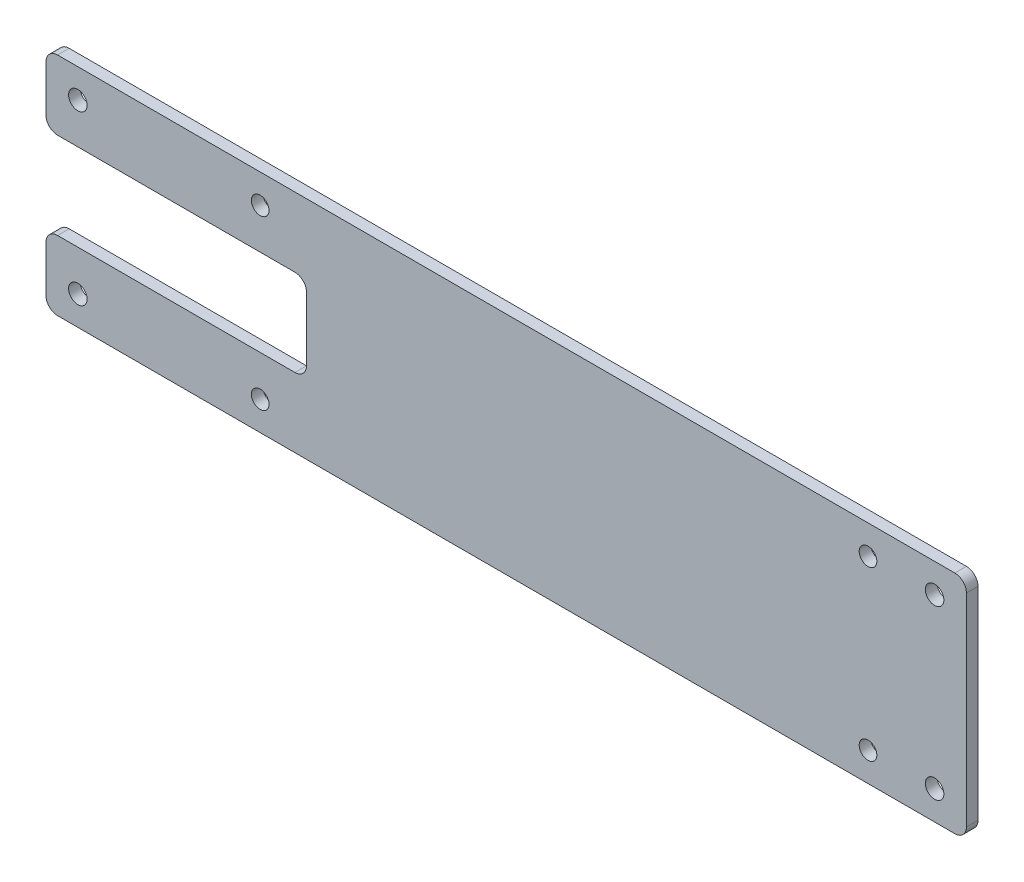
from build123d import *

# Parameters (mm, degrees)
SKETCH_1_W          = 32
SKETCH_1_H          = 39
SKETCH_1_R          = 1.6
SKETCH_1_W_2        = 115
SKETCH_1_R_2        = 1.525
SKETCH_1_W_3        = 12
EXTRUDE_1_DEPTH     = 2
SKETCH_2_W          = 19
SKETCH_2_H          = 15
SKETCH_2_W_2        = 26
CUT_EXTRUDE_1_DEPTH = 10
FILLET_1_R          = 2


with BuildPart() as part:
    # 草图1 → 凸台-拉伸1 (new body)
    # profile 1 of 3: a face of its own
    with BuildSketch(Plane.XY):
        with Locations((-73.5, 0)):
            Rectangle(SKETCH_1_W, SKETCH_1_H)
        with Locations((-84, -14.5)):
            Circle(SKETCH_1_R, mode=Mode.SUBTRACT)
        with Locations((-84, 14.5)):
            Circle(SKETCH_1_R, mode=Mode.SUBTRACT)
    # profile 2 of 3: a face of its own
    with BuildSketch(Plane.XY):
        Rectangle(SKETCH_1_W_2, SKETCH_1_H)
        with Locations((52.5, 14.5)):
            Circle(SKETCH_1_R_2, mode=Mode.SUBTRACT)
        with Locations((52.5, -14.5)):
            Circle(SKETCH_1_R_2, mode=Mode.SUBTRACT)
        with Locations((-52.5, -14.5)):
            Circle(SKETCH_1_R_2, mode=Mode.SUBTRACT)
        with Locations((-52.5, 14.5)):
            Circle(SKETCH_1_R_2, mode=Mode.SUBTRACT)
    # profile 3 of 3: a face of its own
    with BuildSketch(Plane.XY):
        with Locations((63.5, 0)):
            Rectangle(SKETCH_1_W_3, SKETCH_1_H)
        with Locations((64, -14.5)):
            Circle(SKETCH_1_R, mode=Mode.SUBTRACT)
        with Locations((64, 14.5)):
            Circle(SKETCH_1_R, mode=Mode.SUBTRACT)
    extrude(amount=EXTRUDE_1_DEPTH)

    # 草图2 → 切除-拉伸1 (cut)
    with BuildSketch(Plane.XY.offset(2)):
        with Locations((-80, 0)):
            Rectangle(SKETCH_2_W, SKETCH_2_H)
        with Locations((-57.5, 0)):
            Rectangle(SKETCH_2_W_2, SKETCH_2_H)
    extrude(amount=-CUT_EXTRUDE_1_DEPTH, mode=Mode.SUBTRACT)

    # 圆角1
    fillet_1_edges = [part.edges().sort_by_distance(p)[0] for p in [
        (-89.5, 19.5, 1),
        (69.5, 19.5, 1),
        (69.5, -19.5, 1),
        (-89.5, -19.5, 1),
        (-44.5, -7.5, 1),
        (-89.5, -7.5, 1),
        (-89.5, 7.5, 1),
        (-44.5, 7.5, 1),
    ]]
    fillet(fillet_1_edges, radius=FILLET_1_R)


solid = part.part
